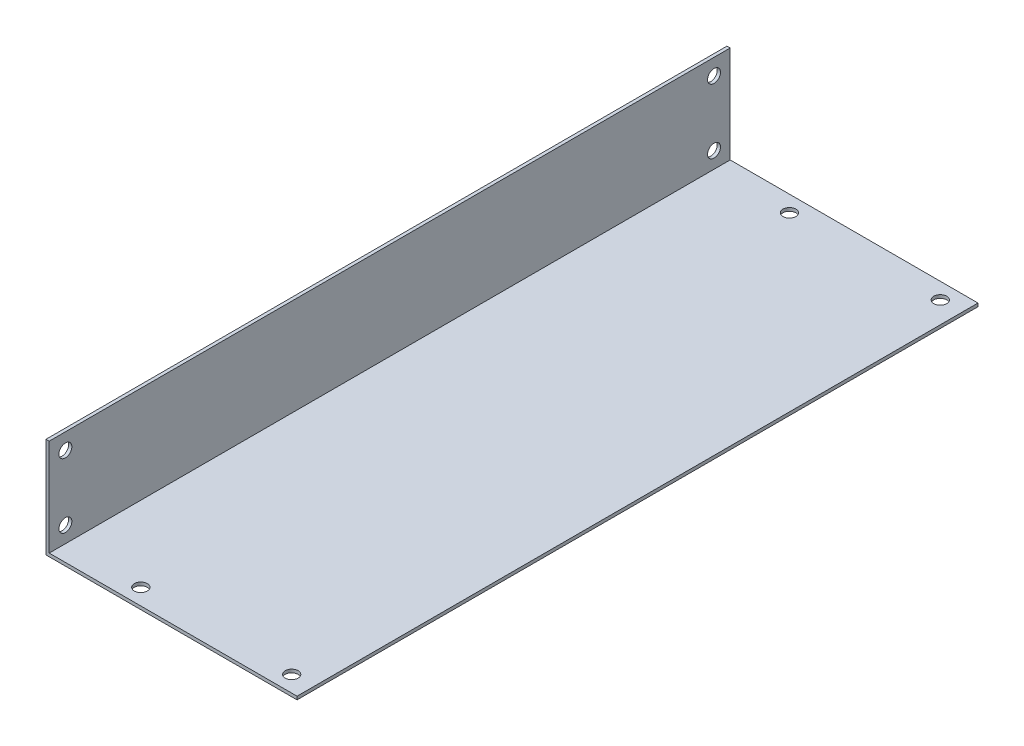
from build123d import *

# Parameters (mm, degrees)
BOSS_EXTRUDE1_DEPTH = 316
CUT_EXTRUDE1_REACH  = 341.986
SKETCH2_R           = 3
CUT_EXTRUDE2_REACH  = 341.986
SKETCH3_R           = 3


with BuildPart() as part:
    # Sketch1 → Boss-Extrude1 (new body)
    with BuildSketch(Plane.XY):
        Polygon((0, 0), (0, -46.5), (116.5, -46.5), (116.5, -45), (1.5, -45), (1.5, 0), align=None)
    extrude(amount=BOSS_EXTRUDE1_DEPTH)

    # Sketch2 → Cut-Extrude1 (cut, up to next)
    with BuildSketch(Plane.ZY, mode=Mode.PRIVATE) as cut_extrude1_sk1:
        with Locations(Location((7.5, -7.5, 0), (0, 0, 270))):
            Circle(SKETCH2_R)
    cut_extrude1_tool1 = extrude(cut_extrude1_sk1.sketch, amount=-CUT_EXTRUDE1_REACH, mode=Mode.PRIVATE) & part.part
    # Sketch2 → Cut-Extrude1 (cut, up to next)
    with BuildSketch(Plane.ZY, mode=Mode.PRIVATE) as cut_extrude1_sk2:
        with Locations(Location((7.5, -37.5, 0), (0, 0, 270))):
            Circle(SKETCH2_R)
    cut_extrude1_tool2 = extrude(cut_extrude1_sk2.sketch, amount=-CUT_EXTRUDE1_REACH, mode=Mode.PRIVATE) & part.part
    # Sketch2 → Cut-Extrude1 (cut, up to next)
    with BuildSketch(Plane.ZY, mode=Mode.PRIVATE) as cut_extrude1_sk3:
        with Locations(Location((308.5, -37.5, 0), (0, 0, 270))):
            Circle(SKETCH2_R)
    cut_extrude1_tool3 = extrude(cut_extrude1_sk3.sketch, amount=-CUT_EXTRUDE1_REACH, mode=Mode.PRIVATE) & part.part
    # Sketch2 → Cut-Extrude1 (cut, up to next)
    with BuildSketch(Plane.ZY, mode=Mode.PRIVATE) as cut_extrude1_sk4:
        with Locations(Location((308.5, -7.5, 0), (0, 0, 270))):
            Circle(SKETCH2_R)
    cut_extrude1_tool4 = extrude(cut_extrude1_sk4.sketch, amount=-CUT_EXTRUDE1_REACH, mode=Mode.PRIVATE) & part.part
    add(cut_extrude1_tool1.solids().sort_by_distance((0, -7.5, 7.5))[0], mode=Mode.SUBTRACT)
    add(cut_extrude1_tool2.solids().sort_by_distance((0, -37.5, 7.5))[0], mode=Mode.SUBTRACT)
    add(cut_extrude1_tool3.solids().sort_by_distance((0, -37.5, 308.5))[0], mode=Mode.SUBTRACT)
    add(cut_extrude1_tool4.solids().sort_by_distance((0, -7.5, 308.5))[0], mode=Mode.SUBTRACT)

    # Sketch3 → Cut-Extrude2 (cut, up to next)
    with BuildSketch(Plane.XZ.offset(46.5), mode=Mode.PRIVATE) as cut_extrude2_sk1:
        with Locations(Location((106.5, 308.5, 0), (0, 0, 270))):
            Circle(SKETCH3_R)
    cut_extrude2_tool1 = extrude(cut_extrude2_sk1.sketch, amount=-CUT_EXTRUDE2_REACH, mode=Mode.PRIVATE) & part.part
    # Sketch3 → Cut-Extrude2 (cut, up to next)
    with BuildSketch(Plane.XZ.offset(46.5), mode=Mode.PRIVATE) as cut_extrude2_sk2:
        with Locations(Location((36.5, 308.5, 0), (0, 0, 270))):
            Circle(SKETCH3_R)
    cut_extrude2_tool2 = extrude(cut_extrude2_sk2.sketch, amount=-CUT_EXTRUDE2_REACH, mode=Mode.PRIVATE) & part.part
    # Sketch3 → Cut-Extrude2 (cut, up to next)
    with BuildSketch(Plane.XZ.offset(46.5), mode=Mode.PRIVATE) as cut_extrude2_sk3:
        with Locations(Location((106.5, 7.5, 0), (0, 0, 270))):
            Circle(SKETCH3_R)
    cut_extrude2_tool3 = extrude(cut_extrude2_sk3.sketch, amount=-CUT_EXTRUDE2_REACH, mode=Mode.PRIVATE) & part.part
    # Sketch3 → Cut-Extrude2 (cut, up to next)
    with BuildSketch(Plane.XZ.offset(46.5), mode=Mode.PRIVATE) as cut_extrude2_sk4:
        with Locations(Location((36.5, 7.5, 0), (0, 0, 270))):
            Circle(SKETCH3_R)
    cut_extrude2_tool4 = extrude(cut_extrude2_sk4.sketch, amount=-CUT_EXTRUDE2_REACH, mode=Mode.PRIVATE) & part.part
    add(cut_extrude2_tool1.solids().sort_by_distance((106.5, -46.5, 308.5))[0], mode=Mode.SUBTRACT)
    add(cut_extrude2_tool2.solids().sort_by_distance((36.5, -46.5, 308.5))[0], mode=Mode.SUBTRACT)
    add(cut_extrude2_tool3.solids().sort_by_distance((106.5, -46.5, 7.5))[0], mode=Mode.SUBTRACT)
    add(cut_extrude2_tool4.solids().sort_by_distance((36.5, -46.5, 7.5))[0], mode=Mode.SUBTRACT)


solid = part.part
